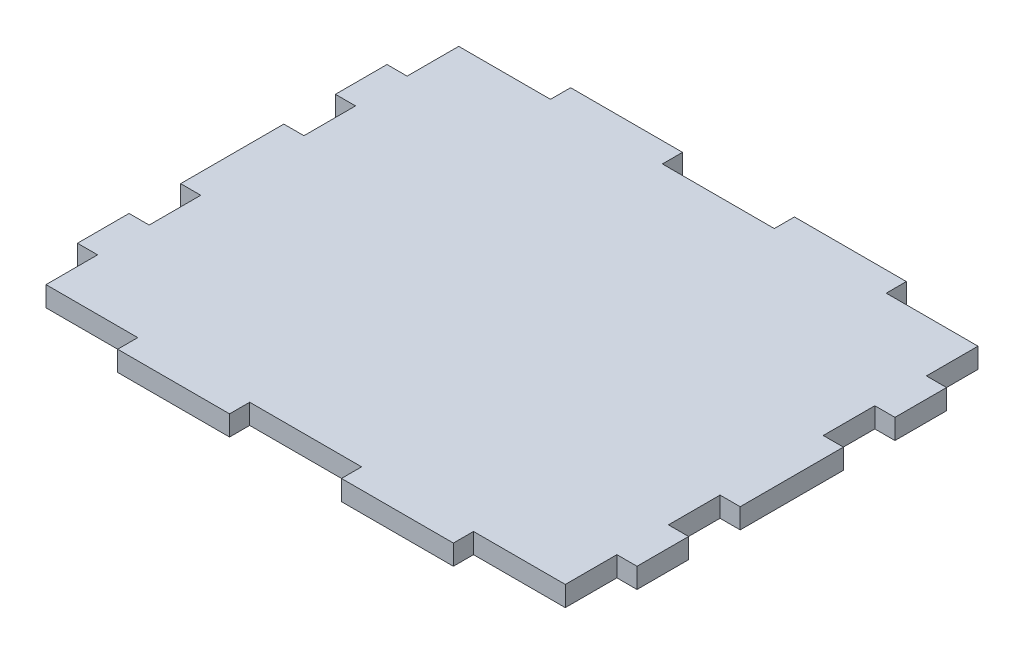
from build123d import *

# Parameters (mm, degrees)
SKETCH1_W           = 200.5584
SKETCH1_H           = 162.3568
BOSS_EXTRUDE1_DEPTH = 7.2136
SKETCH2_W           = 7.2136
SKETCH2_H           = 18.4912
SKETCH2_W_2         = 20.05584
SKETCH2_H_2         = 7.2136
SKETCH2_W_3         = 40.11168
CUT_EXTRUDE1_DEPTH  = 200.347884659


with BuildPart() as part:
    # Sketch1 → Boss-Extrude1 (new body)
    with BuildSketch(Plane(origin=(0, 0, 0), x_dir=(1, 0, 0), z_dir=(0, 1, 0))):
        with Locations((54.486535415, -44.261267707)):
            Rectangle(SKETCH1_W, SKETCH1_H)
    extrude(amount=BOSS_EXTRUDE1_DEPTH)

    # Sketch2 → Cut-Extrude1 (cut, through all)
    with BuildSketch(Plane(origin=(0, 7.2136, 0), x_dir=(1, 0, 0), z_dir=(0, 1, 0))):
        with Locations((-42.185864585, -71.998067707)):
            Rectangle(SKETCH2_W, SKETCH2_H)
        with Locations((-42.185864585, -108.980467707)):
            Rectangle(SKETCH2_W, SKETCH2_H)
        Polygon((-45.792664585, -125.439667707), (-5.680984585, -125.439667707), (-5.680984585, -118.226067707), (-38.579064585, -118.226067707), (-45.792664585, -118.226067707), align=None)
        with Locations((64.514455415, -121.832867707)):
            Rectangle(SKETCH2_W_2, SKETCH2_H_2)
        with Locations((44.458615415, -121.832867707)):
            Rectangle(SKETCH2_W_2, SKETCH2_H_2)
        with Locations((134.709895415, -121.832867707)):
            Rectangle(SKETCH2_W_3, SKETCH2_H_2)
        with Locations((151.158935415, -108.980467707)):
            Rectangle(SKETCH2_W, SKETCH2_H)
        with Locations((151.158935415, -71.998067707)):
            Rectangle(SKETCH2_W, SKETCH2_H)
        with Locations((151.158935415, -16.524467707)):
            Rectangle(SKETCH2_W, SKETCH2_H)
        with Locations((151.158935415, 20.457932293)):
            Rectangle(SKETCH2_W, SKETCH2_H)
        with Locations((134.709895415, 33.310332293)):
            Rectangle(SKETCH2_W_3, SKETCH2_H_2)
        with Locations((54.486535415, 33.310332293)):
            Rectangle(SKETCH2_W_3, SKETCH2_H_2)
        with Locations((-42.185864585, -16.524467707)):
            Rectangle(SKETCH2_W, SKETCH2_H)
        with Locations((-42.185864585, 20.457932293)):
            Rectangle(SKETCH2_W, SKETCH2_H)
        with Locations((-25.736824585, 33.310332293)):
            Rectangle(SKETCH2_W_3, SKETCH2_H_2)
    extrude(amount=-CUT_EXTRUDE1_DEPTH, mode=Mode.SUBTRACT)


solid = part.part
